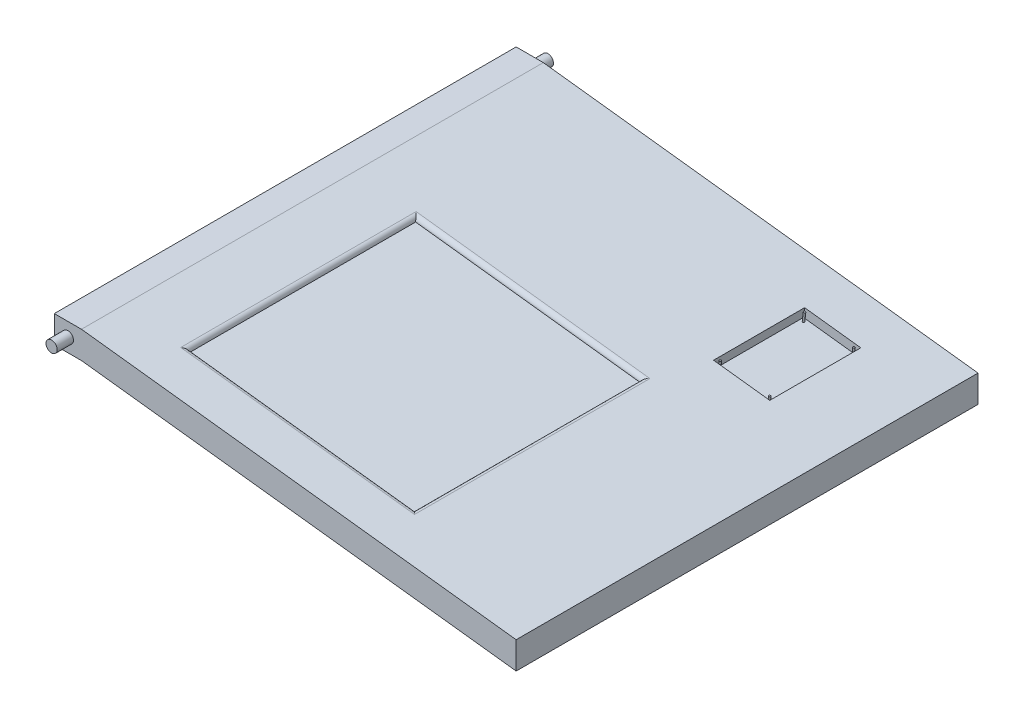
from build123d import *

# Parameters (mm, degrees)
SKETCH1_R                = 6.181856154
BOSS_EXTRUDE2_DEPTH      = 510
BOSS_EXTRUDE3_DEPTH      = 18
BOSS_EXTRUDE3_DEPTH_BACK = 471
SKETCH2_R                = 6.181856154
SKETCH3_R                = 6.181856154
BOSS_EXTRUDE4_DEPTH      = 20
SKETCH4_W                = 62.5
SKETCH4_H                = 100.5
SKETCH4_R                = 1
CUT_EXTRUDE1_DEPTH       = 10
SKETCH5_W                = 250
SKETCH5_H                = 250
CUT_EXTRUDE2_DEPTH       = 10
FILLET1_R                = 5
SKETCH6_W                = 250
SKETCH6_H                = 250
CUT_EXTRUDE3_DEPTH       = 885
SKETCH7_W                = 250
SKETCH7_H                = 250
BOSS_EXTRUDE5_DEPTH      = 25


with BuildPart() as part:
    # Sketch1 → Boss-Extrude2 (new body)
    with BuildSketch(Plane.XY):
        Polygon((-65.667198797, 100.160717384), (-65.667198797, 70.160717384), (-35.667198797, 70.160717384), (444.332801203, 13.261021336), (444.332801203, 43.261021336), (-35.667198797, 100.160717384), align=None)
        with Locations((-50.667198797, 85.160717384)):
            Circle(SKETCH1_R, mode=Mode.SUBTRACT)
    extrude(amount=BOSS_EXTRUDE2_DEPTH)

    # Sketch2 → Boss-Extrude3 (add, two sides: drawn at the far end of the back side and taken through both)
    with BuildSketch(Plane.XY.offset(510).offset(-BOSS_EXTRUDE3_DEPTH_BACK)):
        with Locations((-50.667198797, 85.160717384)):
            Circle(SKETCH2_R)
    extrude(amount=BOSS_EXTRUDE3_DEPTH + BOSS_EXTRUDE3_DEPTH_BACK)

    # Sketch4 → Cut-Extrude1 (cut)
    with BuildSketch(Plane(origin=(11.214376154, 94.603327041, 0), x_dir=(0.9930472019055131, -0.11771684156326717, 0), z_dir=(0.11771684156326717, 0.9930472019055131, 0))):
        with Locations((324.900894155, -100.25)):
            Rectangle(SKETCH4_W, SKETCH4_H)
        with Locations(Location((297.400894155, -53.75, 0), (0, 0, 180))):
            Circle(SKETCH4_R, mode=Mode.SUBTRACT)
        with Locations((352.400894155, -53.75)):
            Circle(SKETCH4_R, mode=Mode.SUBTRACT)
        with Locations(Location((352.400894155, -146.75, 0), (0, 0, 180))):
            Circle(SKETCH4_R, mode=Mode.SUBTRACT)
        with Locations((297.400894155, -146.75)):
            Circle(SKETCH4_R, mode=Mode.SUBTRACT)
    extrude(amount=-CUT_EXTRUDE1_DEPTH, mode=Mode.SUBTRACT)

    # Sketch5 → Cut-Extrude2 (cut)
    with BuildSketch(Plane(origin=(11.214376154, 94.603327041, 0), x_dir=(0.9930472019055131, -0.11771684156326717, 0), z_dir=(0.11771684156326717, 0.9930472019055131, 0))):
        with Locations((147.790184736, -335)):
            Rectangle(SKETCH5_W, SKETCH5_H)
    extrude(amount=-CUT_EXTRUDE2_DEPTH, mode=Mode.SUBTRACT)

    # Fillet1
    fillet1_edges = [part.edges().sort_by_distance(p)[0] for p in [
        (33.846105337, 91.920538475, 335),
        (157.977005575, 77.205933279, 460),
        (282.107905813, 62.491328084, 335),
        (157.977005575, 77.205933279, 210),
    ]]
    fillet(fillet1_edges, radius=FILLET1_R)

    # Sketch6 → Cut-Extrude3 (cut)
    with BuildSketch(Plane(origin=(10.037207738, 84.672855022, 0), x_dir=(0.9930472019055131, -0.11771684156326716, 0), z_dir=(0.11771684156326716, 0.9930472019055131, 0))):
        with Locations((147.790184736, -335)):
            Rectangle(SKETCH6_W, SKETCH6_H)
    extrude(amount=-CUT_EXTRUDE3_DEPTH, mode=Mode.SUBTRACT)

    # Sketch7 → Boss-Extrude5 (add)
    with BuildSketch(Plane(origin=(7.70742475, 65.019044684, 0), x_dir=(0.9930472019055131, -0.1177168415632672, 0), z_dir=(-0.1177168415632672, -0.9930472019055131, 0))):
        with Locations((147.790184736, 335)):
            Rectangle(SKETCH7_W, SKETCH7_H)
    extrude(amount=-BOSS_EXTRUDE5_DEPTH)


with BuildPart() as body_2:
    # Sketch3 → Boss-Extrude4 (new body)
    with BuildSketch(Plane(origin=(0, 0, 0), x_dir=(-1, 0, 0), z_dir=(0, 0, -1))):
        with Locations((50.667198797, 85.160717384)):
            Circle(SKETCH3_R)
    extrude(amount=BOSS_EXTRUDE4_DEPTH)


solid = Compound([part.part, body_2.part])
